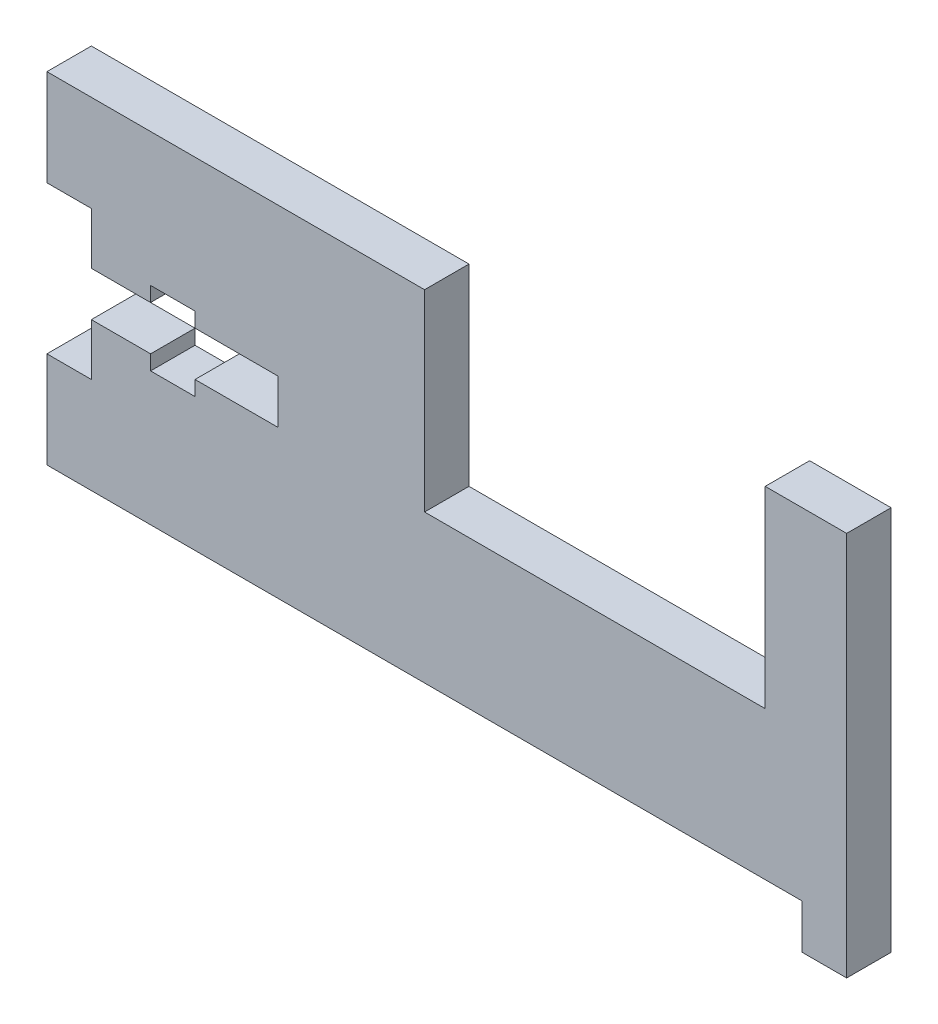
from build123d import *

# Parameters (mm, degrees)
EXTRUDE_1_DEPTH = 3


with BuildPart() as part:
    # 草图1 → 凸台-拉伸1 (new body)
    with BuildSketch(Plane.XY):
        Polygon((0, 0), (0, -26), (-3, -26), (-3, -23), (-54, -23), (-54, -16.5), (-51, -16.5), (-51, -13), (-47, -13), (-47, -14), (-44, -14), (-44, -13), (-38.4, -13), (-38.4, -10), (-44, -10), (-44, -9), (-47, -9), (-47, -10), (-51, -10), (-51, -6.5), (-54, -6.5), (-54, 0), (-28.5, 0), (-28.5, -13), (-5.5, -13), (-5.5, 0), align=None)
    extrude(amount=EXTRUDE_1_DEPTH)


solid = part.part
